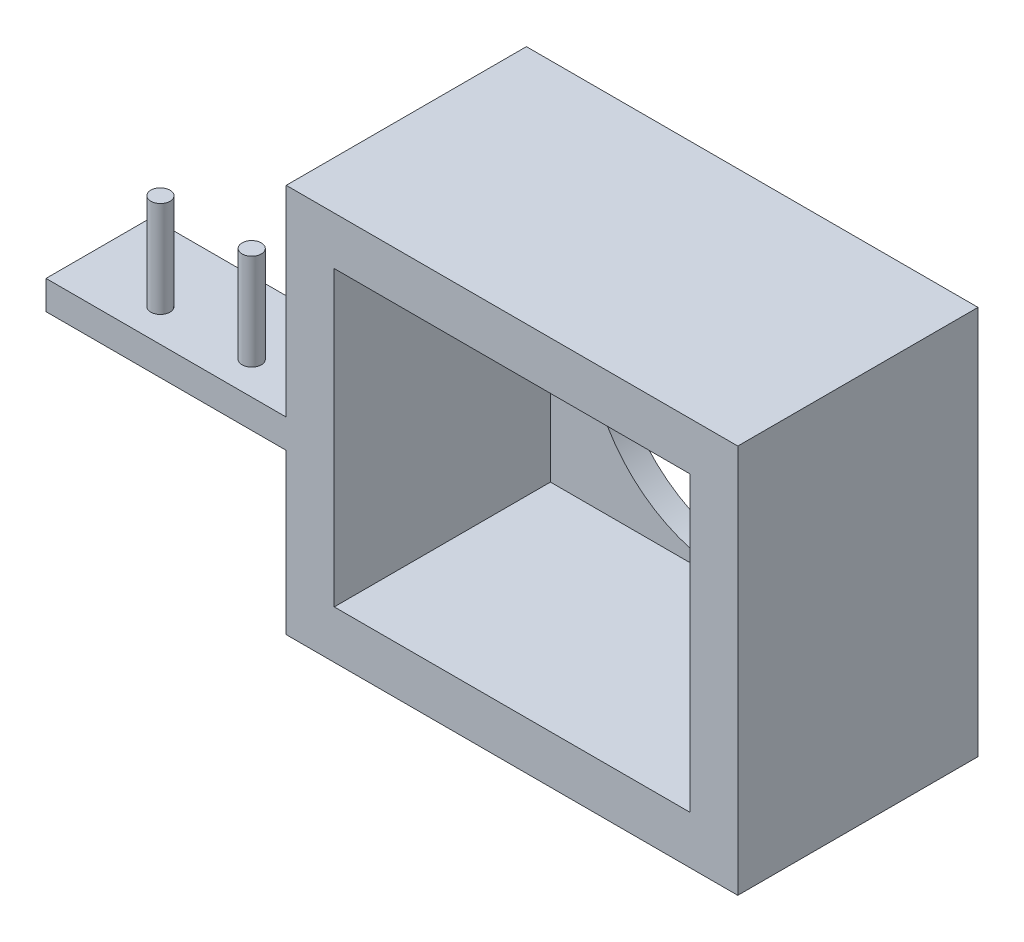
from build123d import *

# Parameters (mm, degrees)
CROQUIS1_W                    = 47
CROQUIS1_H                    = 40.5
SALIENTE_EXTRUIR1_DEPTH       = 25
CROQUIS2_W                    = 10.933851529
CROQUIS2_H                    = 3
SALIENTE_EXTRUIR2_DEPTH       = 25
CROQUIS3_W                    = 37
CROQUIS3_H                    = 30.5
CORTAR_EXTRUIR1_DEPTH         = 22.5
CROQUIS4_W                    = 1
CROQUIS4_H                    = 10
CROQUIS5_W                    = 1
CROQUIS5_H                    = 10
TALADRO_DE_MARGEN_PARA_M251_D = 29


with BuildPart() as part:
    # Croquis1 → Saliente-Extruir1 (new body)
    with BuildSketch(Plane.XY.offset(25)):
        with Locations((-22.24307249, 34.18630066)):
            Rectangle(CROQUIS1_W, CROQUIS1_H)
    extrude(amount=-SALIENTE_EXTRUIR1_DEPTH)

    # Croquis2 → Saliente-Extruir2 (add)
    with BuildSketch(Plane.ZY.offset(45.74307249)):
        with Locations((19.533074236, 32.04630066)):
            Rectangle(CROQUIS2_W, CROQUIS2_H)
    extrude(amount=SALIENTE_EXTRUIR2_DEPTH)

    # Croquis3 → Cortar-Extruir1 (cut)
    with BuildSketch(Plane.XY.offset(25)):
        with Locations((-22.24307249, 34.18630066)):
            Rectangle(CROQUIS3_W, CROQUIS3_H)
    extrude(amount=-CORTAR_EXTRUIR1_DEPTH, mode=Mode.SUBTRACT)

    # Croquis4 → Revolución1 (revolve)
    with BuildSketch(Plane.XY.offset(21.590447053), mode=Mode.PRIVATE) as revoluci_n1_sk:
        with Locations((-52.24307249, 38.54630066)):
            Rectangle(CROQUIS4_W, CROQUIS4_H)
    revolve(revoluci_n1_sk.sketch.rotate(Axis((-52.74307249, 43.54630066, 21.590447053), (0, -1, 0)), 270), axis=Axis((-52.74307249, 43.54630066, 21.590447053), (0, -1, 0)))

    # Croquis5 → Revolución2 (revolve)
    with BuildSketch(Plane.XY.offset(21.590447053), mode=Mode.PRIVATE) as revoluci_n2_sk:
        with Locations((-61.74307249, 38.54630066)):
            Rectangle(CROQUIS5_W, CROQUIS5_H)
    revolve(revoluci_n2_sk.sketch.rotate(Axis((-62.24307249, 43.54630066, 21.590447053), (0, -1, 0)), 270), axis=Axis((-62.24307249, 43.54630066, 21.590447053), (0, -1, 0)))

    # Taladro de margen para M251 (through all)
    with Locations(Plane.XY.offset(2.5)):
        with Locations((-22.24307249, 34.18630066)):
            Hole(TALADRO_DE_MARGEN_PARA_M251_D / 2)


solid = part.part
